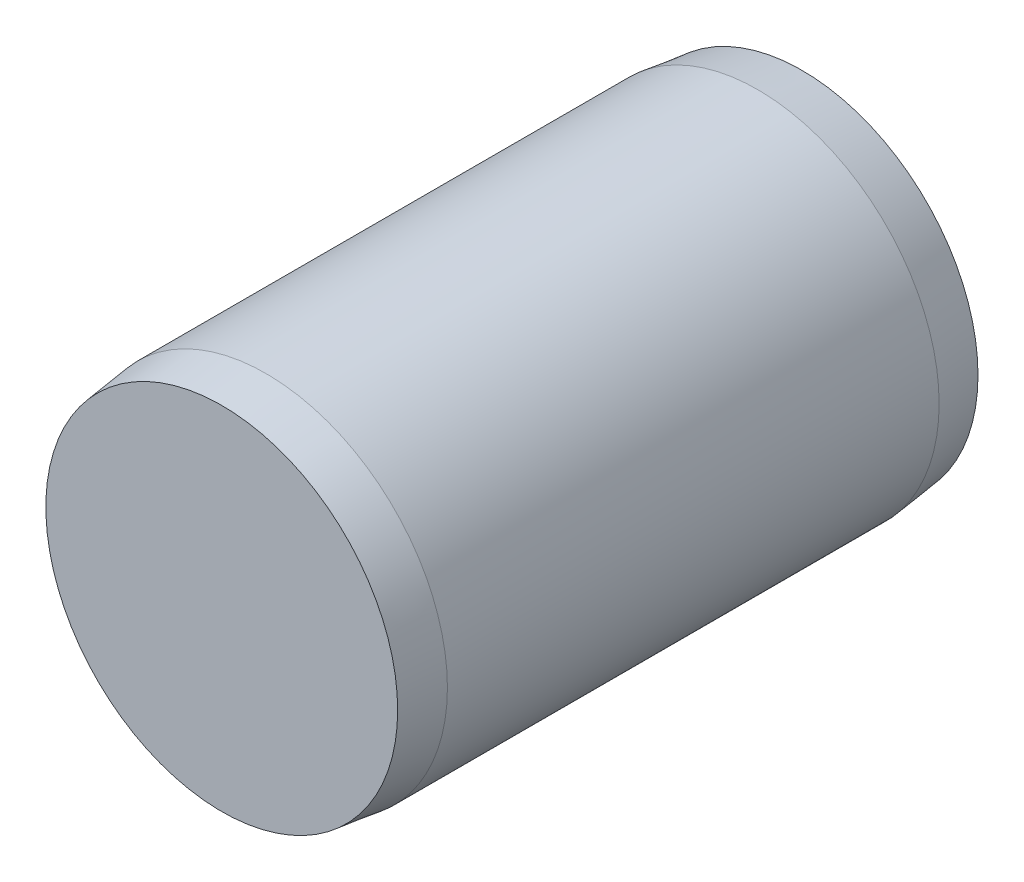
from build123d import *


with BuildPart() as part:
    # Sketch1 → Revolve1 (revolve)
    with BuildSketch(Plane(origin=(0, 0, 0), x_dir=(1, 0, 0), z_dir=(0, 1, 0))):
        Polygon((2.425, 8), (0, 8), (0, 0), (2.425, 0), (2.5, 0.610825982), (2.5, 7.389174018), align=None)
    revolve(axis=Axis((0, 0, -8), (0, 0, 1)))


solid = part.part
